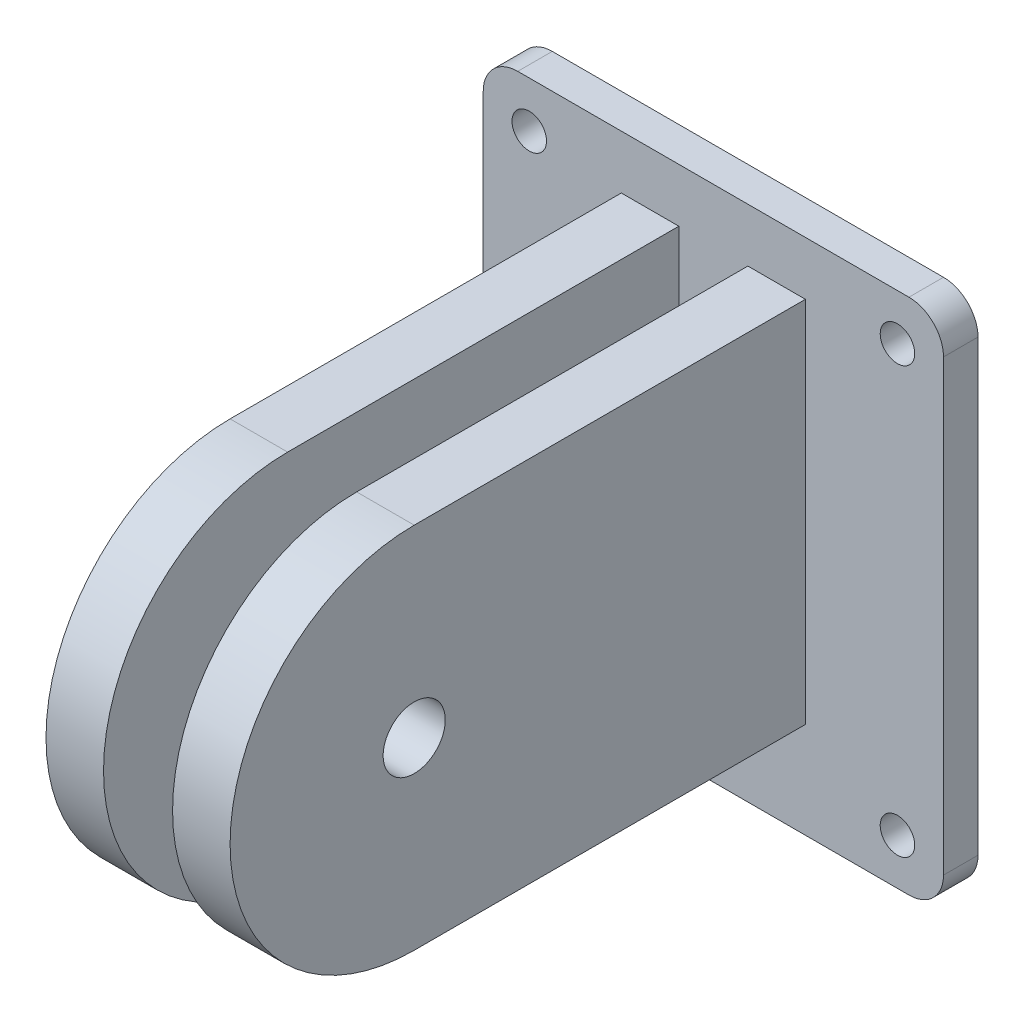
from build123d import *

# Parameters (mm, degrees)
SKETCH1_W           = 40
SKETCH1_H           = 45
BOSS_EXTRUDE1_DEPTH = 3
SKETCH2_W           = 5
SKETCH2_H           = 32
BOSS_EXTRUDE2_DEPTH = 50
SKETCH3_R           = 2.7
CUT_EXTRUDE1_DEPTH  = 451.662125067
FILLET2_R           = 3
SKETCH4_R           = 1.5
CUT_EXTRUDE2_DEPTH  = 450.892599372


with BuildPart() as part:
    # Sketch1 → Boss-Extrude1 (new body)
    with BuildSketch(Plane.XY):
        with Locations((0, 424.157979857)):
            Rectangle(SKETCH1_W, SKETCH1_H)
    extrude(amount=BOSS_EXTRUDE1_DEPTH)

    # Sketch2 → Boss-Extrude2 (add)
    with BuildSketch(Plane.XY.offset(3)):
        with Locations((5.5, 426)):
            Rectangle(SKETCH2_W, SKETCH2_H)
        with Locations((-5.5, 426)):
            Rectangle(SKETCH2_W, SKETCH2_H)
    extrude(amount=BOSS_EXTRUDE2_DEPTH)

    # Sketch3 → Cut-Extrude1 (cut, through all)
    with BuildSketch(Plane(origin=(8, 0, 0), x_dir=(0, 0, -1), z_dir=(1, 0, 0))):
        with Locations(Location((-37, 426, 0), (0, 0, 90))):
            Circle(SKETCH3_R)
        with BuildLine():
            Line((-37, 442), (-57.90422328, 442))
            Line((-57.90422328, 442), (-57.90422328, 410))
            Line((-57.90422328, 410), (-37, 410))
            ThreePointArc((-37, 410), (-53, 426), (-37, 442))
        make_face()
    extrude(amount=-CUT_EXTRUDE1_DEPTH, mode=Mode.SUBTRACT)

    # Fillet2
    fillet2_edges = [part.edges().sort_by_distance(p)[0] for p in [
        (-20, 446.657979857, 1.5),
        (20, 446.657979857, 1.5),
        (20, 401.657979857, 1.5),
        (-20, 401.657979857, 1.5),
    ]]
    fillet(fillet2_edges, radius=FILLET2_R)

    # Sketch4 → Cut-Extrude2 (cut, through all)
    with BuildSketch(Plane.XY.offset(3)):
        with Locations((-16, 442.657979857)):
            Circle(SKETCH4_R)
        with Locations(Location((-16, 405.657979857, 0), (0, 0, 180))):
            Circle(SKETCH4_R)
        with Locations((16, 405.657979857)):
            Circle(SKETCH4_R)
        with Locations(Location((16, 442.657979857, 0), (0, 0, 180))):
            Circle(SKETCH4_R)
    extrude(amount=-CUT_EXTRUDE2_DEPTH, mode=Mode.SUBTRACT)


solid = part.part
